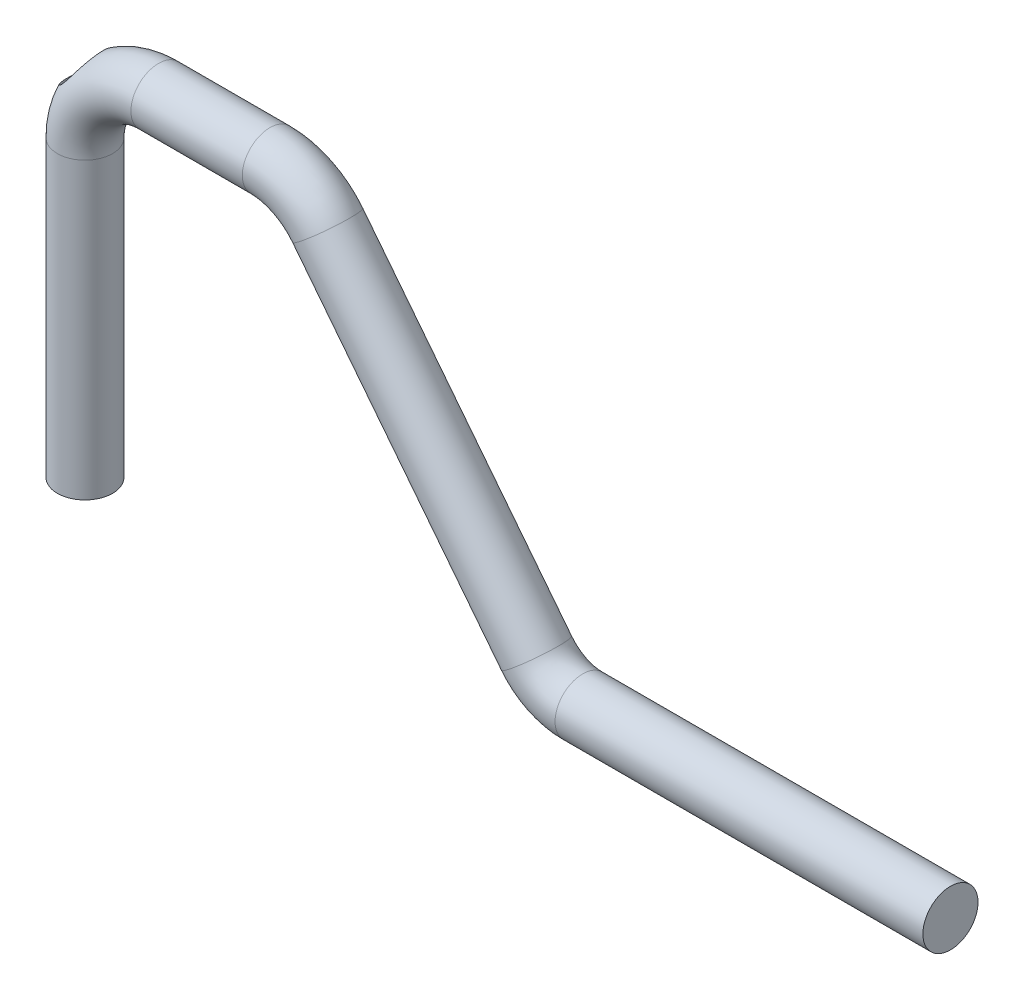
from build123d import *

# Parameters (mm, degrees)
SKETCH2_R          = 9.525
SKETCH6_R          = 6.35
CUT_EXTRUDE1_DEPTH = 139.7


with BuildPart() as part:
    # Sweep1: sweep along a path in Sketch1
    with BuildLine(Plane.XY) as sweep1_path:
        Line((0, 0), (0, 101.6))
        ThreePointArc((0, 101.6), (7.439487758, 119.560512242), (25.4, 127))
        Line((25.4, 127), (63.845922056, 127))
        ThreePointArc((63.845922056, 127), (74.955603314, 124.441518827), (83.827181396, 117.281494672))
        Line((83.827181396, 117.281494672), (155.936708861, 25.4))
        ThreePointArc((155.936708861, 25.4), (162.997624279, 19.70131545), (171.839852681, 17.665012665))
        Line((171.839852681, 17.665012665), (298.839852681, 17.665012665))
    # Sketch2 → Sweep1 (sweep)
    with BuildSketch(Plane(origin=(0, 0, 0), x_dir=(1, 0, 0), z_dir=(0, 1, 0))):
        Circle(SKETCH2_R)
    sweep(path=sweep1_path.line)

    # Sketch6 → Cut-Extrude1 (cut)
    with BuildSketch(Plane.XZ):
        with Locations(Location((0, 0, 0), (0, 0, 270))):
            Circle(SKETCH6_R)
    extrude(amount=-CUT_EXTRUDE1_DEPTH, mode=Mode.SUBTRACT)


solid = part.part
